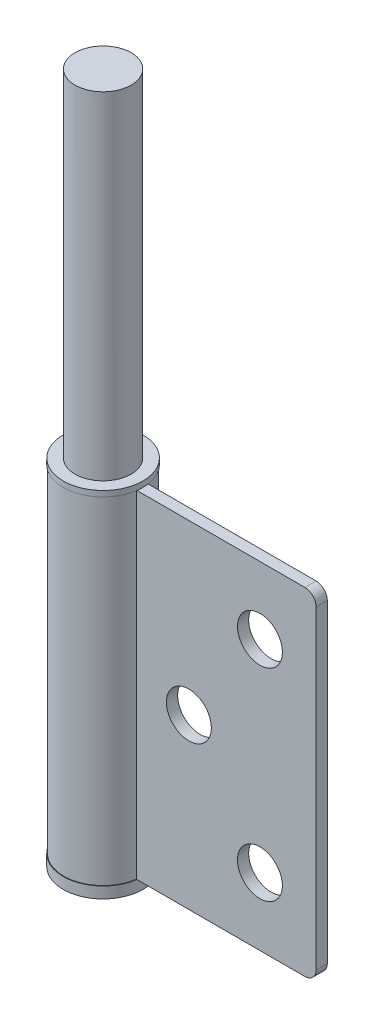
from build123d import *

# Parameters (mm, degrees)
SKETCH_1_R          = 2.5
EXTRUDE_1_DEPTH     = 30
CUT_EXTRUDE_1_REACH = 37.984
SKETCH_2_R          = 2
FILLET_1_R          = 1
SKETCH_3_R          = 2.5
EXTRUDE_2_DEPTH     = 60.5
SKETCH_4_R          = 3.55
EXTRUDE_3_DEPTH     = 1
SKETCH_5_R          = 3.55
SKETCH_5_R_2        = 2.5
EXTRUDE_4_DEPTH     = 0.5


with BuildPart() as part:
    # 草图1 → 凸台-拉伸1 (new body)
    with BuildSketch(Plane(origin=(0, 0, 0), x_dir=(1, 0, 0), z_dir=(0, 1, 0))):
        with BuildLine():
            Line((19.464101615, -0.5), (3.464101615, -0.5))
            ThreePointArc((3.464101615, -0.5), (-3.5, 0), (3.464101615, 0.5))
            Line((3.464101615, 0.5), (19.464101615, 0.5))
            Line((19.464101615, 0.5), (19.464101615, -0.5))
        make_face()
        with Locations(Location((0, 0, 0), (0, 0, 270))):
            Circle(SKETCH_1_R, mode=Mode.SUBTRACT)
    extrude(amount=EXTRUDE_1_DEPTH)

    # 草图2 → 切除-拉伸1 (cut, up to next)
    with BuildSketch(Plane.XY.offset(0.5), mode=Mode.PRIVATE) as cut_extrude_1_sk1:
        with Locations((14.464101615, 24)):
            Circle(SKETCH_2_R)
    cut_extrude_1_tool1 = extrude(cut_extrude_1_sk1.sketch, amount=-CUT_EXTRUDE_1_REACH, mode=Mode.PRIVATE) & part.part
    # 草图2 → 切除-拉伸1 (cut, up to next)
    with BuildSketch(Plane.XY.offset(0.5), mode=Mode.PRIVATE) as cut_extrude_1_sk2:
        with Locations((8.139546295, 15)):
            Circle(SKETCH_2_R)
    cut_extrude_1_tool2 = extrude(cut_extrude_1_sk2.sketch, amount=-CUT_EXTRUDE_1_REACH, mode=Mode.PRIVATE) & part.part
    # 草图2 → 切除-拉伸1 (cut, up to next)
    with BuildSketch(Plane.XY.offset(0.5), mode=Mode.PRIVATE) as cut_extrude_1_sk3:
        with Locations((14.464101615, 6)):
            Circle(SKETCH_2_R)
    cut_extrude_1_tool3 = extrude(cut_extrude_1_sk3.sketch, amount=-CUT_EXTRUDE_1_REACH, mode=Mode.PRIVATE) & part.part
    add(cut_extrude_1_tool1.solids().sort_by_distance((14.464102, 24, 0.5))[0], mode=Mode.SUBTRACT)
    add(cut_extrude_1_tool2.solids().sort_by_distance((8.139546, 15, 0.5))[0], mode=Mode.SUBTRACT)
    add(cut_extrude_1_tool3.solids().sort_by_distance((14.464102, 6, 0.5))[0], mode=Mode.SUBTRACT)

    # 圆角1
    fillet_1_edges = [part.edges().sort_by_distance(p)[0] for p in [
        (19.464101615, 30, 0),
        (19.464101615, 0, 0),
    ]]
    fillet(fillet_1_edges, radius=FILLET_1_R)

    # 草图3 → 凸台-拉伸2 (add)
    with BuildSketch(Plane.XZ):
        with Locations(Location((0, 0, 0), (0, 0, 270))):
            Circle(SKETCH_3_R)
    extrude(amount=-EXTRUDE_2_DEPTH)

    # 草图4 → 凸台-拉伸3 (add)
    with BuildSketch(Plane.XZ):
        with Locations(Location((0, 0, 0), (0, 0, 8.09674977))):
            Circle(SKETCH_4_R)
    extrude(amount=EXTRUDE_3_DEPTH)

    # 草图5 → 凸台-拉伸4 (add)
    with BuildSketch(Plane(origin=(0, 30, 0), x_dir=(1, 0, 0), z_dir=(0, 1, 0))):
        with Locations(Location((0, 0, 0), (0, 0, 351.90325023))):
            Circle(SKETCH_5_R)
        with Locations(Location((0, 0, 0), (0, 0, 90))):
            Circle(SKETCH_5_R_2, mode=Mode.SUBTRACT)
    extrude(amount=EXTRUDE_4_DEPTH)


solid = part.part
